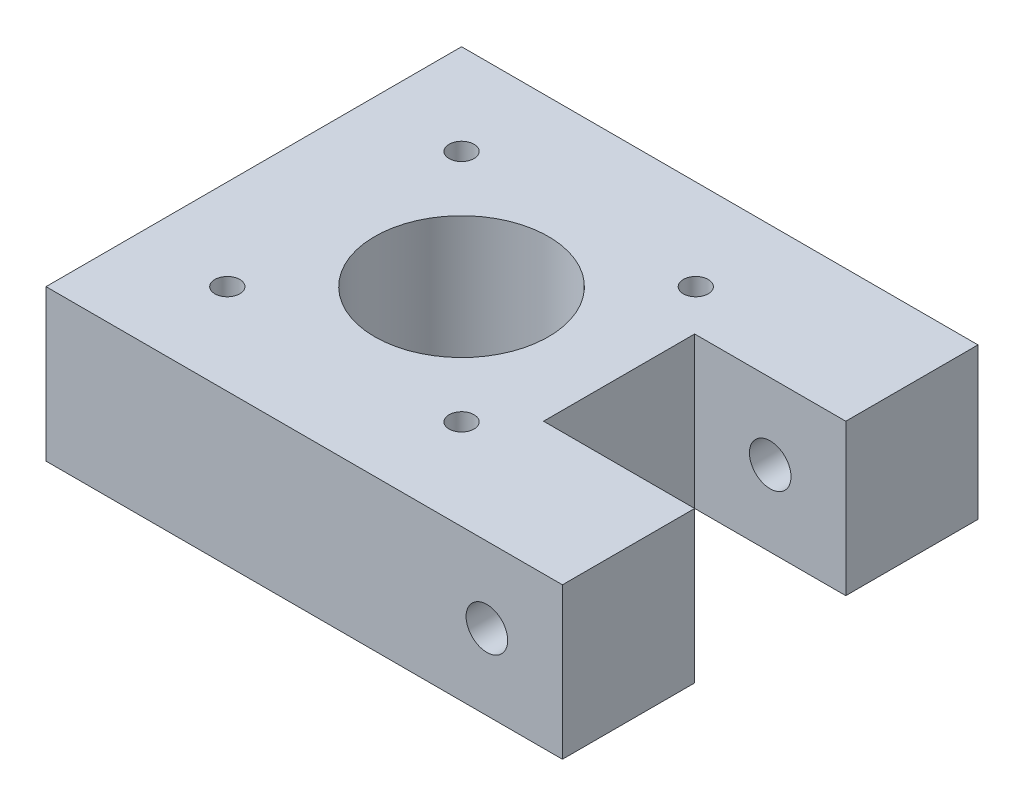
from build123d import *

# Parameters (mm, degrees)
SKETCH_1_R          = 1.65
SKETCH_1_R_2        = 11.5
EXTRUDE_1_DEPTH     = 20
SKETCH_6_W          = 17.5
SKETCH_6_H          = 20
EXTRUDE_2_DEPTH     = 20
SKETCH_7_R          = 3
CUT_EXTRUDE_1_DEPTH = 16
SKETCH_8_R          = 2.75
CUT_EXTRUDE_2_DEPTH = 72.370319461


with BuildPart() as part:
    # 草图1 → 凸台-拉伸1 (new body)
    with BuildSketch(Plane(origin=(0, 0, 0), x_dir=(1, 0, 0), z_dir=(0, 1, 0))):
        Polygon((20.85, 20.85), (20.85, 27.5), (-27.5, 27.5), (-27.5, -27.5), (20.85, -27.5), align=None)
        with Locations(Location((-15.5, 15.5, 0), (0, 0, 270))):
            Circle(SKETCH_1_R, mode=Mode.SUBTRACT)
        with Locations(Location((15.5, 15.5, 0), (0, 0, 270))):
            Circle(SKETCH_1_R, mode=Mode.SUBTRACT)
        with Locations(Location((15.5, -15.5, 0), (0, 0, 270))):
            Circle(SKETCH_1_R, mode=Mode.SUBTRACT)
        with Locations(Location((-15.5, -15.5, 0), (0, 0, 270))):
            Circle(SKETCH_1_R, mode=Mode.SUBTRACT)
        with Locations(Location((0, 0, 0), (0, 0, 270))):
            Circle(SKETCH_1_R_2, mode=Mode.SUBTRACT)
    extrude(amount=EXTRUDE_1_DEPTH)

    # 草图6 → 凸台-拉伸2 (add)
    with BuildSketch(Plane(origin=(20.85, 0, 0), x_dir=(0, 0, -1), z_dir=(1, 0, 0))):
        with Locations((18.75, 10)):
            Rectangle(SKETCH_6_W, SKETCH_6_H)
        with Locations((-18.75, 10)):
            Rectangle(SKETCH_6_W, SKETCH_6_H)
    extrude(amount=EXTRUDE_2_DEPTH)

    # 草图7 → 切除-拉伸1 (cut)
    with BuildSketch(Plane.XZ):
        with Locations(Location((-15.5, 15.5, 0), (0, 0, 270))):
            Circle(SKETCH_7_R)
        with Locations(Location((15.5, 15.5, 0), (0, 0, 270))):
            Circle(SKETCH_7_R)
        with Locations(Location((15.5, -15.5, 0), (0, 0, 270))):
            Circle(SKETCH_7_R)
        with Locations(Location((-15.5, -15.5, 0), (0, 0, 270))):
            Circle(SKETCH_7_R)
    extrude(amount=-CUT_EXTRUDE_1_DEPTH, mode=Mode.SUBTRACT)

    # 草图8 → 切除-拉伸2 (cut, through all)
    with BuildSketch(Plane(origin=(0, 0, -27.5), x_dir=(-1, 0, 0), z_dir=(0, 0, -1))):
        with Locations((-30.85, 10)):
            Circle(SKETCH_8_R)
    extrude(amount=-CUT_EXTRUDE_2_DEPTH, mode=Mode.SUBTRACT)


solid = part.part
